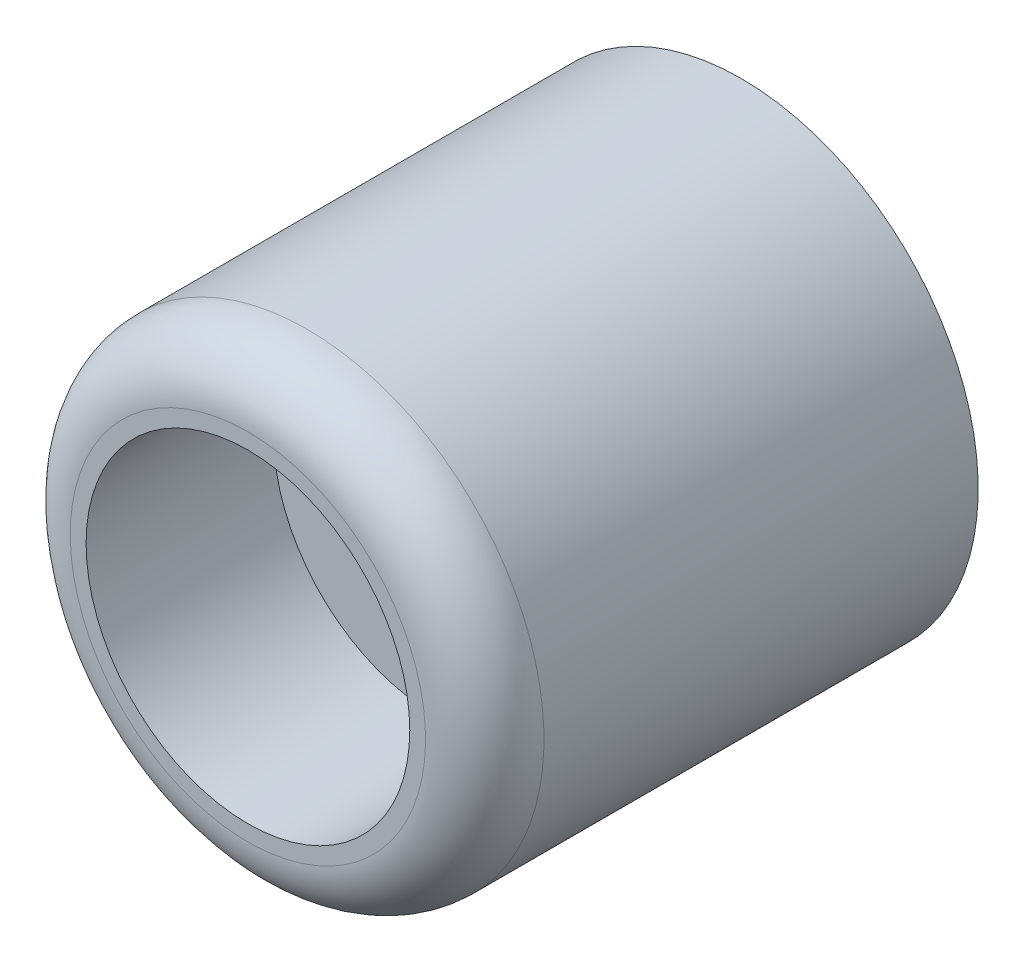
from build123d import *


with BuildPart() as part:
    # Sketch1 → Revolve1 (revolve)
    with BuildSketch(Plane(origin=(0, 0, 0), x_dir=(0, 0, -1), z_dir=(1, 0, 0))):
        with BuildLine():
            Line((0, 4.7625), (0, 6.096))
            Line((0, 6.096), (-11.176, 6.096))
            ThreePointArc((-11.176, 6.096), (-12.253630735, 5.649630735), (-12.7, 4.572))
            Line((-12.7, 4.572), (-12.7, 4.1656))
            Line((-12.7, 4.1656), (-7.874, 4.1656))
            Line((-7.874, 4.1656), (-7.874, 2.4257))
            Line((-7.874, 2.4257), (-2.3368, 2.4257))
            Line((-2.3368, 2.4257), (0, 4.7625))
        make_face()
    revolve(axis=Axis((0, 0, 12.7), (0, 0, 1)))


solid = part.part
